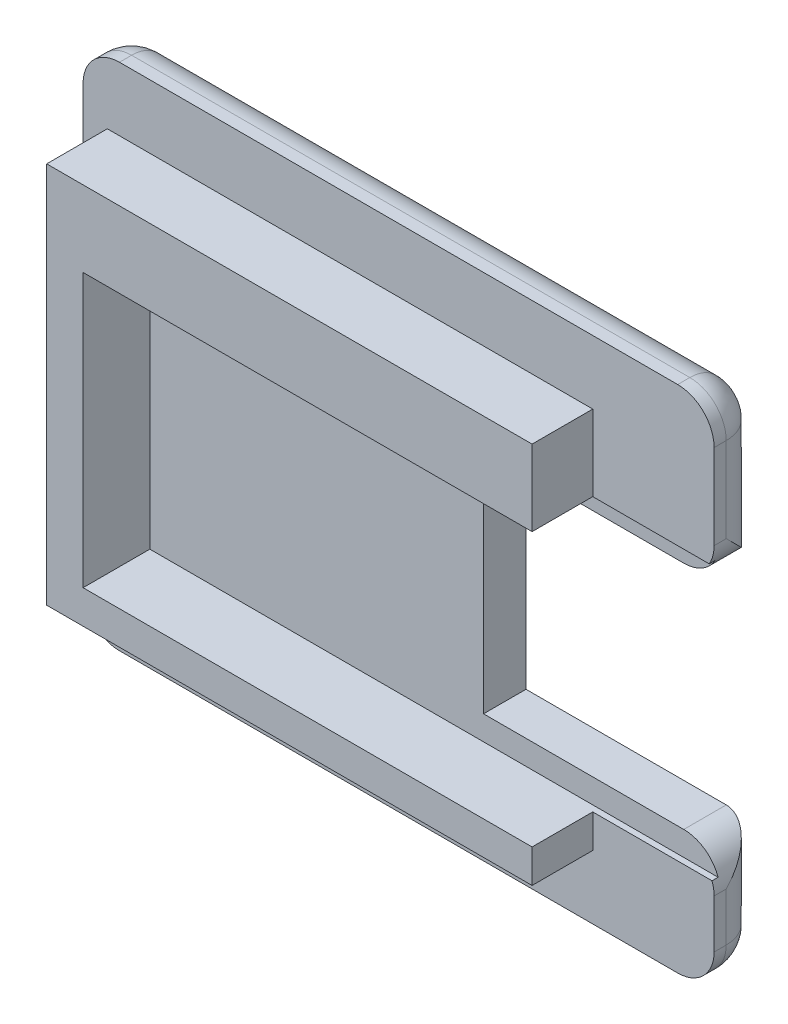
from build123d import *

# Parameters (mm, degrees)
SKETCH1_W           = 52
SKETCH1_H           = 42
BOSS_EXTRUDE1_DEPTH = 4
SKETCH2_W           = 40
SKETCH2_H           = 31.5
BOSS_EXTRUDE2_DEPTH = 5
SKETCH4_W           = 50
SKETCH4_H           = 22.5
CUT_EXTRUDE2_DEPTH  = 5.5
SKETCH5_W           = 19.5
SKETCH5_H           = 19
CUT_EXTRUDE3_DEPTH  = 10
FILLET2_R           = 3


with BuildPart() as part:
    # Sketch1 → Boss-Extrude1 (new body)
    with BuildSketch(Plane.XY):
        Rectangle(SKETCH1_W, SKETCH1_H)
    extrude(amount=BOSS_EXTRUDE1_DEPTH)

    # Sketch2 → Boss-Extrude2 (add)
    with BuildSketch(Plane.XY.offset(4)):
        with Locations((-4, 0)):
            Rectangle(SKETCH2_W, SKETCH2_H)
    extrude(amount=BOSS_EXTRUDE2_DEPTH)

    # Sketch4 → Cut-Extrude2 (cut)
    with BuildSketch(Plane.XY.offset(9)):
        with Locations((4, -1.75)):
            Rectangle(SKETCH4_W, SKETCH4_H)
    extrude(amount=-CUT_EXTRUDE2_DEPTH, mode=Mode.SUBTRACT)

    # Sketch5 → Cut-Extrude3 (cut)
    with BuildSketch(Plane.XY.offset(3.5)):
        with Locations((16.25, -1.5)):
            Rectangle(SKETCH5_W, SKETCH5_H)
    extrude(amount=-CUT_EXTRUDE3_DEPTH, mode=Mode.SUBTRACT)

    # Fillet2
    fillet2_edges = [part.edges().sort_by_distance(p)[0] for p in [
        (26, -16, 0),
        (26, 14.5, 0),
        (26, 8, 1.75),
        (26, -11, 1.75),
        (26, -21, 2),
        (-26, -21, 2),
        (0, -21, 0),
        (-26, 0, 0),
        (0, 21, 0),
        (-26, 21, 2),
        (26, 21, 2),
    ]]
    fillet(fillet2_edges, radius=FILLET2_R)


solid = part.part
